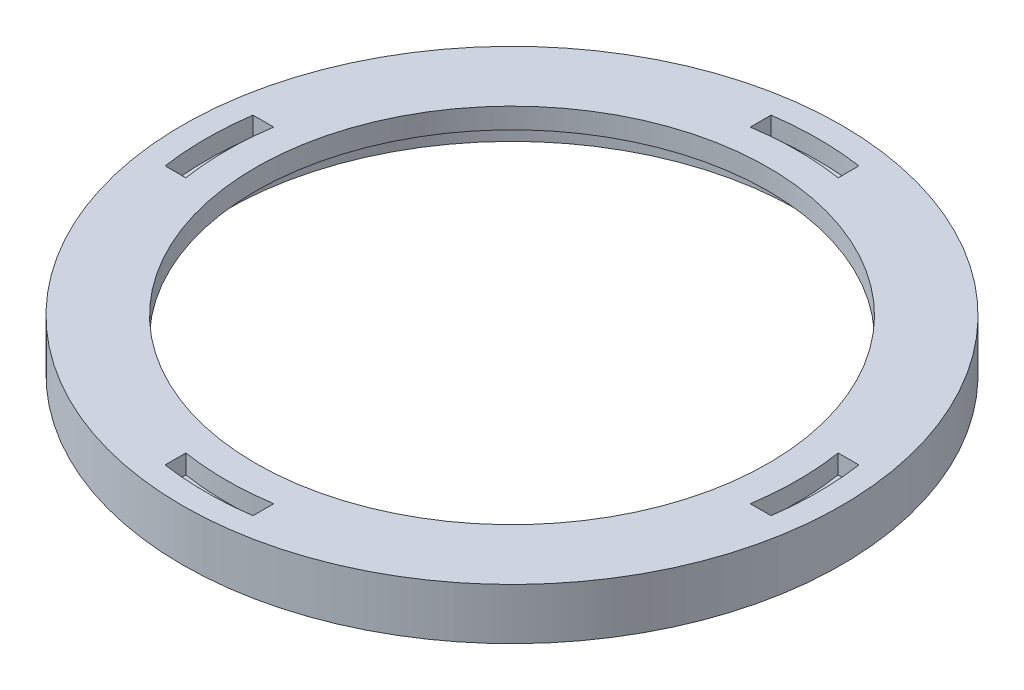
from build123d import *

# Parameters (mm, degrees)
SKETCH1_R            = 28.575
SHAFT_DEPTH          = 4.445
SKETCH11_R           = 22.225
THRU_HOLE_DEPTH      = 41.654880088
TOOLING_POINTS_DEPTH = 1.651
RETAINER_START       = -2.667
SKETCH12_R           = 24.765
RETAINER_HOLE_DEPTH  = 2.667


with BuildPart() as part:
    # Sketch1 → Shaft (new body)
    with BuildSketch(Plane(origin=(0, 0, 0), x_dir=(1, 0, 0), z_dir=(0, 1, 0))):
        Circle(SKETCH1_R)
    extrude(amount=-SHAFT_DEPTH)

    # Sketch11 → Thru Hole (cut, through all)
    with BuildSketch(Plane(origin=(0, 0, 0), x_dir=(-1, 0, 0), z_dir=(0, 1, 0))):
        Circle(SKETCH11_R)
    extrude(amount=-THRU_HOLE_DEPTH, mode=Mode.SUBTRACT)

    # Sketch13 → Tooling Points (cut)
    with BuildSketch(Plane(origin=(0, 0, 0), x_dir=(-1, 0, 0), z_dir=(0, 1, 0))):
        with BuildLine():
            Line((-24.470168062, -3.81), (-26.268131814, -3.81))
            ThreePointArc((-26.268131814, -3.81), (-26.543, 0), (-26.268131814, 3.81))
            Line((-26.268131814, 3.81), (-24.470168062, 3.81))
            ThreePointArc((-24.470168062, 3.81), (-24.765, 0), (-24.470168062, -3.81))
        make_face()
        with BuildLine():
            Line((3.81, -24.470168062), (3.81, -26.268131814))
            ThreePointArc((3.81, -26.268131814), (0, -26.543), (-3.81, -26.268131814))
            Line((-3.81, -26.268131814), (-3.81, -24.470168062))
            ThreePointArc((-3.81, -24.470168062), (0, -24.765), (3.81, -24.470168062))
        make_face()
        with BuildLine():
            Line((24.470168062, 3.81), (26.268131814, 3.81))
            ThreePointArc((26.268131814, 3.81), (26.543, 0), (26.268131814, -3.81))
            Line((26.268131814, -3.81), (24.470168062, -3.81))
            ThreePointArc((24.470168062, -3.81), (24.765, 0), (24.470168062, 3.81))
        make_face()
        with BuildLine():
            Line((-3.81, 24.470168062), (-3.81, 26.268131814))
            ThreePointArc((-3.81, 26.268131814), (0, 26.543), (3.81, 26.268131814))
            Line((3.81, 26.268131814), (3.81, 24.470168062))
            ThreePointArc((3.81, 24.470168062), (0, 24.765), (-3.81, 24.470168062))
        make_face()
    extrude(amount=-TOOLING_POINTS_DEPTH, mode=Mode.SUBTRACT)

    # Sketch12 → Retainer Hole (cut)
    with BuildSketch(Plane.XZ.offset(4.445).offset(RETAINER_START)):
        Circle(SKETCH12_R)
    extrude(amount=RETAINER_HOLE_DEPTH, mode=Mode.SUBTRACT)


solid = part.part
